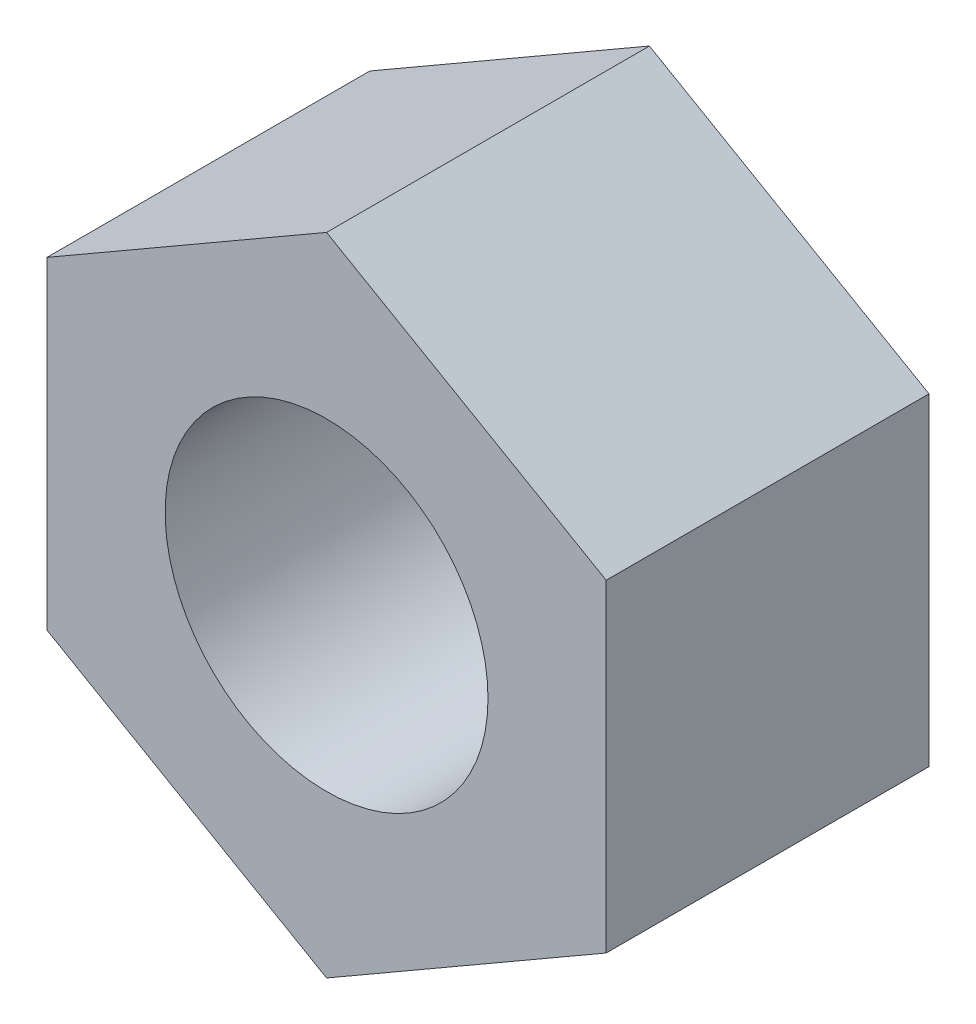
from build123d import *

# Parameters (mm, degrees)
SKETCH1_R           = 5
BOSS_EXTRUDE1_DEPTH = 10


with BuildPart() as part:
    # Sketch1 → Boss-Extrude1 (new body)
    with BuildSketch(Plane.XY):
        Polygon((8.660254038, 5), (0, 10), (-8.660254038, 5), (-8.660254038, -5), (0, -10), (8.660254038, -5), align=None)
        Circle(SKETCH1_R, mode=Mode.SUBTRACT)
    extrude(amount=BOSS_EXTRUDE1_DEPTH)


solid = part.part
